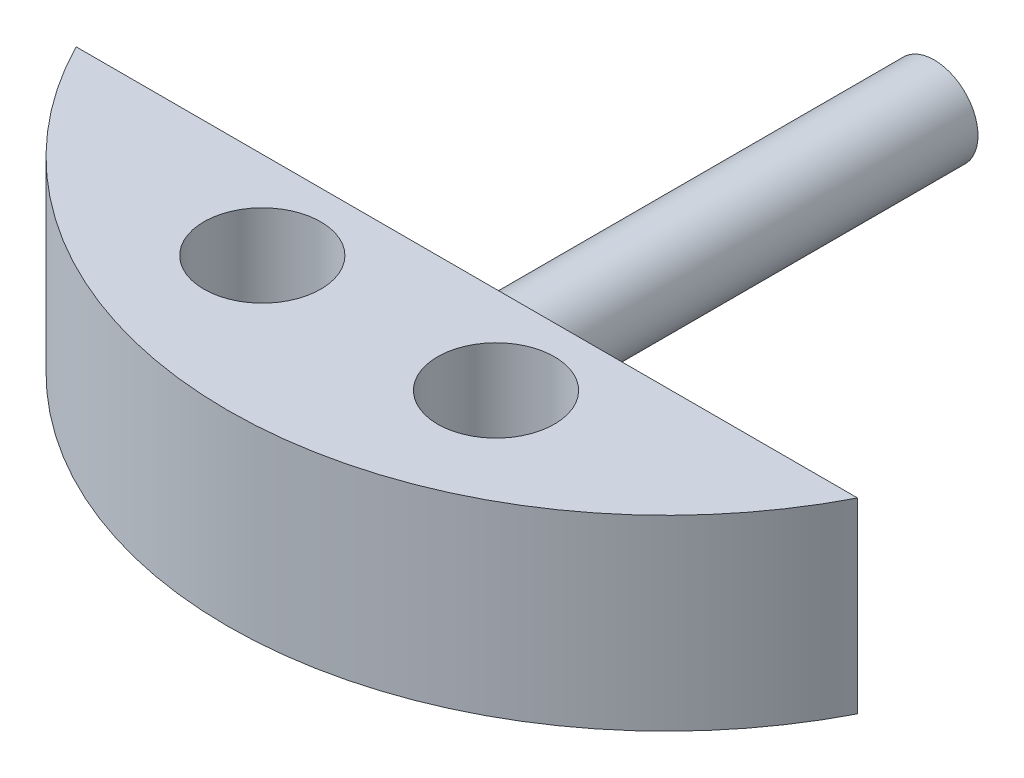
from build123d import *

# Parameters (mm, degrees)
SKETCH1_R           = 6.35
BOSS_EXTRUDE1_DEPTH = 20.32
SKETCH2_R           = 4.7498
BOSS_EXTRUDE2_DEPTH = 50.8


with BuildPart() as part:
    # Sketch1 → Boss-Extrude1 (new body)
    with BuildSketch(Plane(origin=(0, 0, 0), x_dir=(1, 0, 0), z_dir=(0, 1, 0))):
        with BuildLine():
            Line((-42.460023894, -21.710352443), (42.460023894, -21.710352443))
            ThreePointArc((42.460023894, -21.710352443), (0, -47.6885), (-42.460023894, -21.710352443))
        make_face()
        with Locations(Location((-12.7, -31.235352443, 0), (0, 0, 270))):
            Circle(SKETCH1_R, mode=Mode.SUBTRACT)
        with Locations(Location((12.7, -31.235352443, 0), (0, 0, 270))):
            Circle(SKETCH1_R, mode=Mode.SUBTRACT)
    extrude(amount=BOSS_EXTRUDE1_DEPTH)

    # Sketch2 → Boss-Extrude2 (add)
    with BuildSketch(Plane(origin=(0, 0, 21.710352443), x_dir=(-1, 0, 0), z_dir=(0, 0, -1))):
        with Locations(Location((0, 10.16, 0), (0, 0, 180))):
            Circle(SKETCH2_R)
    extrude(amount=BOSS_EXTRUDE2_DEPTH)


solid = part.part
